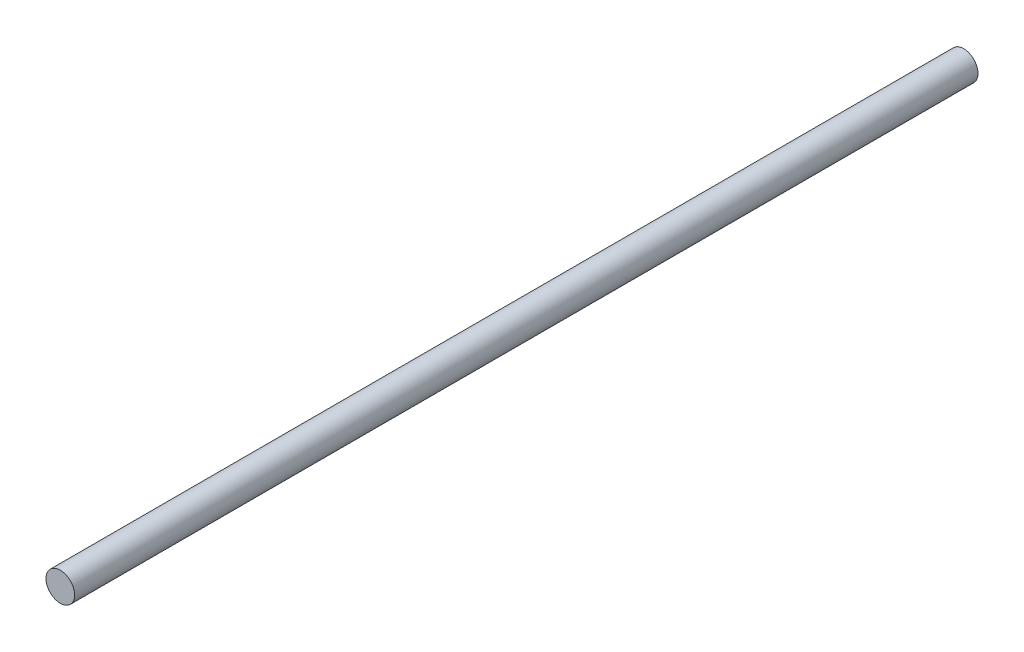
from build123d import *

# Parameters (mm, degrees)
SKETCH1_R           = 5
BOSS_EXTRUDE1_DEPTH = 315


with BuildPart() as part:
    # Sketch1 → Boss-Extrude1 (new body)
    with BuildSketch(Plane(origin=(0, 0, 0), x_dir=(0, 1, 0), z_dir=(0, 0, 1))):
        with Locations(Location((0, 0, 0), (0, 0, 270))):
            Circle(SKETCH1_R)
    extrude(amount=BOSS_EXTRUDE1_DEPTH)


solid = part.part
